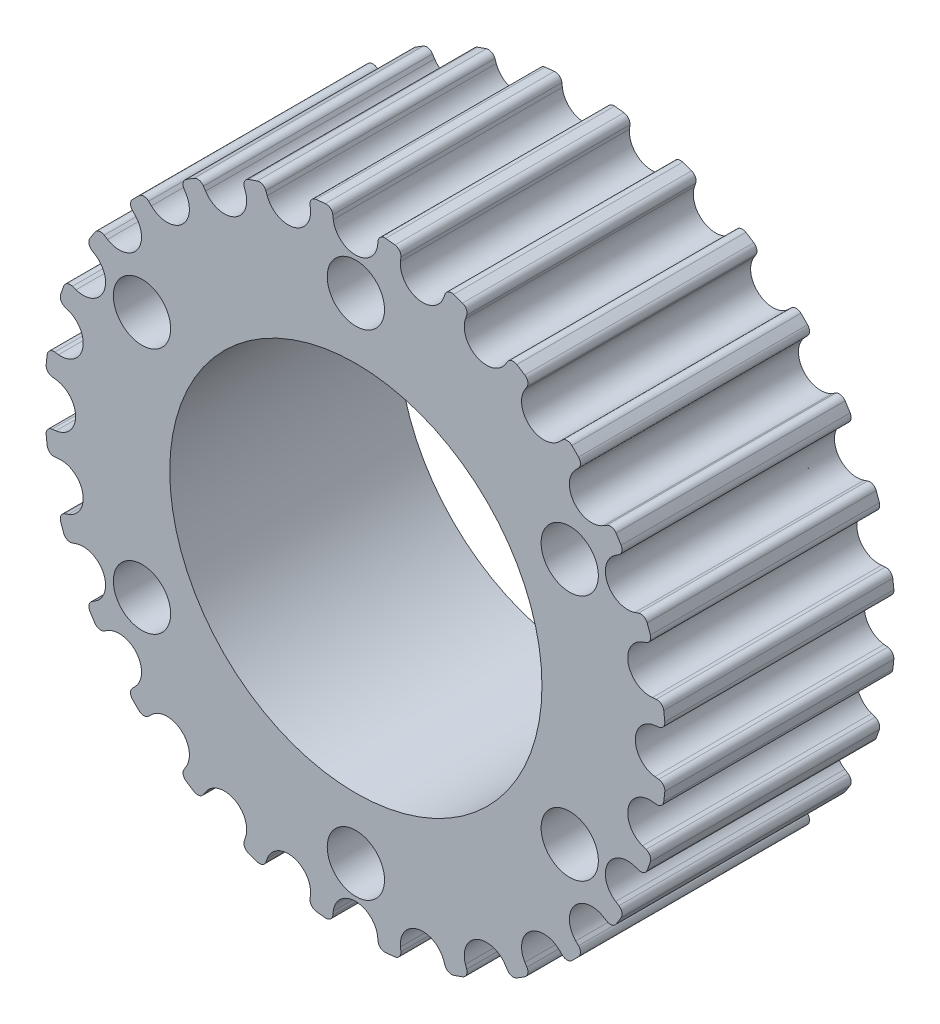
from build123d import *

# Parameters (mm, degrees)
SKETCH_1_R          = 7.5
EXTRUDE_1_DEPTH     = 16
SKETCH_7_R          = 2
SKETCH_7_R_2        = 13
CUT_EXTRUDE_1_DEPTH = 41


with BuildPart() as part:
    # 草图1 → 凸台-拉伸1 (new body)
    with BuildSketch(Plane.XY):
        with BuildLine():
            Line((1.554033471, 21.184411781), (1.521048557, 20.915771216))
            ThreePointArc((1.521048557, 20.915771216), (-0.027323439, 19.545887392), (-1.575695436, 20.915771216))
            Line((-1.575695436, 20.915771216), (-1.608680349, 21.184411781))
            ThreePointArc((-1.608680349, 21.184411781), (-1.784864491, 21.500423691), (-2.131632272, 21.603653945))
            ThreePointArc((-2.131632272, 21.603653945), (-2.457848286, 21.569392044), (-2.783509374, 21.530205035))
            ThreePointArc((-2.783509374, 21.530205035), (-3.09861207, 21.352399889), (-3.200059642, 21.005106398))
            Line((-3.200059642, 21.005106398), (-3.172439406, 20.735861379))
            ThreePointArc((-3.172439406, 20.735861379), (-4.377162656, 19.055778219), (-6.191541562, 20.046771013))
            Line((-6.191541562, 20.046771013), (-6.283477625, 20.301336364))
            ThreePointArc((-6.283477625, 20.301336364), (-6.525563727, 20.570220536), (-6.886608208, 20.593699501))
            ThreePointArc((-6.886608208, 20.593699501), (-7.197021316, 20.487706726), (-7.505797471, 20.377035808))
            ThreePointArc((-7.505797471, 20.377035808), (-7.773434517, 20.133571662), (-7.795058515, 19.772411335))
            Line((-7.795058515, 19.772411335), (-7.708218122, 19.516062931))
            ThreePointArc((-7.708218122, 19.516062931), (-8.508882771, 17.610026822), (-10.498288052, 18.172436068))
            Line((-10.498288052, 18.172436068), (-10.644565205, 18.400161236))
            ThreePointArc((-10.644565205, 18.400161236), (-10.940414061, 18.608434695), (-11.297630964, 18.550985038))
            ThreePointArc((-11.297630964, 18.550985038), (-11.576675756, 18.378576309), (-11.853083652, 18.201970983))
            ThreePointArc((-11.853083652, 18.201970983), (-12.059834609, 17.905056146), (-12.000550715, 17.54813907))
            Line((-12.000550715, 17.54813907), (-11.858844707, 17.317541662))
            ThreePointArc((-11.858844707, 17.317541662), (-12.215302086, 15.281129211), (-14.279976653, 15.386753363))
            Line((-14.279976653, 15.386753363), (-14.47325995, 15.576219257))
            ThreePointArc((-14.47325995, 15.576219257), (-14.808036462, 15.713438301), (-15.14351344, 15.577940788))
            ThreePointArc((-15.14351344, 15.577940788), (-15.377197445, 15.347761398), (-15.607376836, 15.114077393))
            ThreePointArc((-15.607376836, 15.114077393), (-15.742874348, 14.778600415), (-15.605655304, 14.443823903))
            Line((-15.605655304, 14.443823903), (-15.41618941, 14.250540606))
            ThreePointArc((-15.41618941, 14.250540606), (-15.310565258, 12.185866039), (-17.346977709, 11.829408659))
            Line((-17.346977709, 11.829408659), (-17.577575117, 11.971114668))
            ThreePointArc((-17.577575117, 11.971114668), (-17.934492193, 12.030398562), (-18.23140703, 11.823647605))
            ThreePointArc((-18.23140703, 11.823647605), (-18.408012356, 11.547239709), (-18.580421086, 11.268194917))
            ThreePointArc((-18.580421086, 11.268194917), (-18.637870742, 10.910978014), (-18.429597284, 10.615129158))
            Line((-18.429597284, 10.615129158), (-18.201872116, 10.468852005))
            ThreePointArc((-18.201872116, 10.468852005), (-17.639462869, 8.479446724), (-19.545498979, 7.678782075))
            Line((-19.545498979, 7.678782075), (-19.801847382, 7.765622467))
            ThreePointArc((-19.801847382, 7.765622467), (-20.163007709, 7.74399847), (-20.406471855, 7.476361423))
            ThreePointArc((-20.406471855, 7.476361423), (-20.517142773, 7.167585269), (-20.623135549, 6.857172161))
            ThreePointArc((-20.623135549, 6.857172161), (-20.599656583, 6.49612768), (-20.330772412, 6.254041577))
            Line((-20.330772412, 6.254041577), (-20.07620706, 6.162105515))
            ThreePointArc((-20.07620706, 6.162105515), (-19.085214266, 4.347726609), (-20.765297426, 3.143003359))
            Line((-20.765297426, 3.143003359), (-21.034542445, 3.170623595))
            ThreePointArc((-21.034542445, 3.170623595), (-21.381835936, 3.069176023), (-21.559641082, 2.754073327))
            ThreePointArc((-21.559641082, 2.754073327), (-21.598828091, 2.428412239), (-21.633089992, 2.102196225))
            ThreePointArc((-21.633089992, 2.102196225), (-21.529859738, 1.755428444), (-21.213847828, 1.579244302))
            Line((-21.213847828, 1.579244302), (-20.945207263, 1.546259388))
            ThreePointArc((-20.945207263, 1.546259388), (-19.575323439, -0.002112608), (-20.945207263, -1.550484605))
            Line((-20.945207263, -1.550484605), (-21.213847828, -1.583469519))
            ThreePointArc((-21.213847828, -1.583469519), (-21.529859738, -1.75965366), (-21.633089992, -2.106421441))
            ThreePointArc((-21.633089992, -2.106421441), (-21.598828091, -2.432637455), (-21.559641082, -2.758298543))
            ThreePointArc((-21.559641082, -2.758298543), (-21.381835936, -3.073401239), (-21.034542445, -3.174848812))
            Line((-21.034542445, -3.174848812), (-20.765297426, -3.147228575))
            ThreePointArc((-20.765297426, -3.147228575), (-19.085214266, -4.351951825), (-20.07620706, -6.166330731))
            Line((-20.07620706, -6.166330731), (-20.330772412, -6.258266794))
            ThreePointArc((-20.330772412, -6.258266794), (-20.599656583, -6.500352897), (-20.623135549, -6.861397377))
            ThreePointArc((-20.623135549, -6.861397377), (-20.517142773, -7.171810485), (-20.406471855, -7.48058664))
            ThreePointArc((-20.406471855, -7.48058664), (-20.163007709, -7.748223686), (-19.801847382, -7.769847684))
            Line((-19.801847382, -7.769847684), (-19.545498979, -7.683007291))
            ThreePointArc((-19.545498979, -7.683007291), (-17.639462869, -8.48367194), (-18.201872116, -10.473077221))
            Line((-18.201872116, -10.473077221), (-18.429597284, -10.619354374))
            ThreePointArc((-18.429597284, -10.619354374), (-18.637870742, -10.91520323), (-18.580421086, -11.272420133))
            ThreePointArc((-18.580421086, -11.272420133), (-18.408012356, -11.551464925), (-18.23140703, -11.827872821))
            ThreePointArc((-18.23140703, -11.827872821), (-17.934492193, -12.034623778), (-17.577575117, -11.975339884))
            Line((-17.577575117, -11.975339884), (-17.346977709, -11.833633876))
            ThreePointArc((-17.346977709, -11.833633876), (-15.310565258, -12.190091255), (-15.41618941, -14.254765823))
            Line((-15.41618941, -14.254765823), (-15.605655304, -14.448049119))
            ThreePointArc((-15.605655304, -14.448049119), (-15.742874348, -14.782825631), (-15.607376836, -15.11830261))
            ThreePointArc((-15.607376836, -15.11830261), (-15.377197445, -15.351986614), (-15.14351344, -15.582166005))
            ThreePointArc((-15.14351344, -15.582166005), (-14.808036462, -15.717663517), (-14.47325995, -15.580444473))
            Line((-14.47325995, -15.580444473), (-14.279976653, -15.390978579))
            ThreePointArc((-14.279976653, -15.390978579), (-12.215302086, -15.285354427), (-11.858844707, -17.321766878))
            Line((-11.858844707, -17.321766878), (-12.000550715, -17.552364287))
            ThreePointArc((-12.000550715, -17.552364287), (-12.059834609, -17.909281362), (-11.853083652, -18.206196199))
            ThreePointArc((-11.853083652, -18.206196199), (-11.576675756, -18.382801525), (-11.297630964, -18.555210255))
            ThreePointArc((-11.297630964, -18.555210255), (-10.940414061, -18.612659911), (-10.644565205, -18.404386453))
            Line((-10.644565205, -18.404386453), (-10.498288052, -18.176661285))
            ThreePointArc((-10.498288052, -18.176661285), (-8.508882771, -17.614252038), (-7.708218122, -19.520288148))
            Line((-7.708218122, -19.520288148), (-7.795058515, -19.776636551))
            ThreePointArc((-7.795058515, -19.776636551), (-7.773434517, -20.137796878), (-7.505797471, -20.381261024))
            ThreePointArc((-7.505797471, -20.381261024), (-7.197021316, -20.491931943), (-6.886608208, -20.597924718))
            ThreePointArc((-6.886608208, -20.597924718), (-6.525563727, -20.574445752), (-6.283477625, -20.305561581))
            Line((-6.283477625, -20.305561581), (-6.191541562, -20.050996229))
            ThreePointArc((-6.191541562, -20.050996229), (-4.377162656, -19.060003436), (-3.172439406, -20.740086595))
            Line((-3.172439406, -20.740086595), (-3.200059642, -21.009331614))
            ThreePointArc((-3.200059642, -21.009331614), (-3.09861207, -21.356625105), (-2.783509374, -21.534430251))
            ThreePointArc((-2.783509374, -21.534430251), (-2.457848286, -21.573617261), (-2.131632272, -21.607879161))
            ThreePointArc((-2.131632272, -21.607879161), (-1.784864491, -21.504648907), (-1.608680349, -21.188636997))
            Line((-1.608680349, -21.188636997), (-1.575695436, -20.919996432))
            ThreePointArc((-1.575695436, -20.919996432), (-0.027323439, -19.550112608), (1.521048557, -20.919996432))
            Line((1.521048557, -20.919996432), (1.554033471, -21.188636997))
            ThreePointArc((1.554033471, -21.188636997), (1.730217613, -21.504648907), (2.076985394, -21.607879161))
            ThreePointArc((2.076985394, -21.607879161), (2.403201408, -21.573617261), (2.728862496, -21.534430251))
            ThreePointArc((2.728862496, -21.534430251), (3.043965192, -21.356625105), (3.145412764, -21.009331614))
            Line((3.145412764, -21.009331614), (3.117792528, -20.740086595))
            ThreePointArc((3.117792528, -20.740086595), (4.322515778, -19.060003436), (6.136894684, -20.050996229))
            Line((6.136894684, -20.050996229), (6.228830746, -20.305561581))
            ThreePointArc((6.228830746, -20.305561581), (6.470916849, -20.574445752), (6.83196133, -20.597924718))
            ThreePointArc((6.83196133, -20.597924718), (7.142374438, -20.491931943), (7.451150593, -20.381261024))
            ThreePointArc((7.451150593, -20.381261024), (7.718787639, -20.137796878), (7.740411637, -19.776636551))
            Line((7.740411637, -19.776636551), (7.653571244, -19.520288148))
            ThreePointArc((7.653571244, -19.520288148), (8.454235893, -17.614252038), (10.443641174, -18.176661285))
            Line((10.443641174, -18.176661285), (10.589918327, -18.404386453))
            ThreePointArc((10.589918327, -18.404386453), (10.885767183, -18.612659911), (11.242984086, -18.555210255))
            ThreePointArc((11.242984086, -18.555210255), (11.522028878, -18.382801525), (11.798436774, -18.206196199))
            ThreePointArc((11.798436774, -18.206196199), (12.005187731, -17.909281362), (11.945903837, -17.552364287))
            Line((11.945903837, -17.552364287), (11.804197828, -17.321766878))
            ThreePointArc((11.804197828, -17.321766878), (12.160655208, -15.285354427), (14.225329775, -15.390978579))
            Line((14.225329775, -15.390978579), (14.418613072, -15.580444473))
            ThreePointArc((14.418613072, -15.580444473), (14.753389584, -15.717663517), (15.088866562, -15.582166005))
            ThreePointArc((15.088866562, -15.582166005), (15.322550567, -15.351986614), (15.552729958, -15.11830261))
            ThreePointArc((15.552729958, -15.11830261), (15.68822747, -14.782825631), (15.551008426, -14.448049119))
            Line((15.551008426, -14.448049119), (15.361542532, -14.254765823))
            ThreePointArc((15.361542532, -14.254765823), (15.25591838, -12.190091255), (17.292330831, -11.833633876))
            Line((17.292330831, -11.833633876), (17.522928239, -11.975339884))
            ThreePointArc((17.522928239, -11.975339884), (17.879845315, -12.034623778), (18.176760152, -11.827872821))
            ThreePointArc((18.176760152, -11.827872821), (18.353365478, -11.551464925), (18.525774208, -11.272420133))
            ThreePointArc((18.525774208, -11.272420133), (18.583223864, -10.91520323), (18.374950406, -10.619354374))
            Line((18.374950406, -10.619354374), (18.147225238, -10.473077221))
            ThreePointArc((18.147225238, -10.473077221), (17.584815991, -8.48367194), (19.4908521, -7.683007291))
            Line((19.4908521, -7.683007291), (19.747200504, -7.769847684))
            ThreePointArc((19.747200504, -7.769847684), (20.108360831, -7.748223686), (20.351824977, -7.48058664))
            ThreePointArc((20.351824977, -7.48058664), (20.462495895, -7.171810485), (20.568488671, -6.861397377))
            ThreePointArc((20.568488671, -6.861397377), (20.545009705, -6.500352897), (20.276125534, -6.258266794))
            Line((20.276125534, -6.258266794), (20.021560182, -6.166330731))
            ThreePointArc((20.021560182, -6.166330731), (19.030567388, -4.351951825), (20.710650548, -3.147228575))
            Line((20.710650548, -3.147228575), (20.979895567, -3.174848812))
            ThreePointArc((20.979895567, -3.174848812), (21.327189058, -3.073401239), (21.504994204, -2.758298543))
            ThreePointArc((21.504994204, -2.758298543), (21.544181213, -2.432637455), (21.578443114, -2.106421441))
            ThreePointArc((21.578443114, -2.106421441), (21.47521286, -1.75965366), (21.15920095, -1.583469519))
            Line((21.15920095, -1.583469519), (20.890560385, -1.550484605))
            ThreePointArc((20.890560385, -1.550484605), (19.520676561, -0.002112608), (20.890560385, 1.546259388))
            Line((20.890560385, 1.546259388), (21.15920095, 1.579244302))
            ThreePointArc((21.15920095, 1.579244302), (21.47521286, 1.755428444), (21.578443114, 2.102196225))
            ThreePointArc((21.578443114, 2.102196225), (21.544181213, 2.428412239), (21.504994204, 2.754073327))
            ThreePointArc((21.504994204, 2.754073327), (21.327189058, 3.069176023), (20.979895567, 3.170623595))
            Line((20.979895567, 3.170623595), (20.710650548, 3.143003359))
            ThreePointArc((20.710650548, 3.143003359), (19.030567388, 4.347726609), (20.021560182, 6.162105515))
            Line((20.021560182, 6.162105515), (20.276125534, 6.254041577))
            ThreePointArc((20.276125534, 6.254041577), (20.545009705, 6.49612768), (20.568488671, 6.857172161))
            ThreePointArc((20.568488671, 6.857172161), (20.462495895, 7.167585269), (20.351824977, 7.476361423))
            ThreePointArc((20.351824977, 7.476361423), (20.108360831, 7.74399847), (19.747200504, 7.765622467))
            Line((19.747200504, 7.765622467), (19.4908521, 7.678782075))
            ThreePointArc((19.4908521, 7.678782075), (17.584815991, 8.479446724), (18.147225238, 10.468852005))
            Line((18.147225238, 10.468852005), (18.374950406, 10.615129158))
            ThreePointArc((18.374950406, 10.615129158), (18.583223864, 10.910978014), (18.525774208, 11.268194917))
            ThreePointArc((18.525774208, 11.268194917), (18.353365478, 11.547239709), (18.176760152, 11.823647605))
            ThreePointArc((18.176760152, 11.823647605), (17.879845315, 12.030398562), (17.522928239, 11.971114668))
            Line((17.522928239, 11.971114668), (17.292330831, 11.829408659))
            ThreePointArc((17.292330831, 11.829408659), (15.25591838, 12.185866039), (15.361542532, 14.250540606))
            Line((15.361542532, 14.250540606), (15.551008426, 14.443823903))
            ThreePointArc((15.551008426, 14.443823903), (15.68822747, 14.778600415), (15.552729958, 15.114077393))
            ThreePointArc((15.552729958, 15.114077393), (15.322550567, 15.347761398), (15.088866562, 15.577940788))
            ThreePointArc((15.088866562, 15.577940788), (14.753389584, 15.713438301), (14.418613072, 15.576219257))
            Line((14.418613072, 15.576219257), (14.225329775, 15.386753363))
            ThreePointArc((14.225329775, 15.386753363), (12.160655208, 15.281129211), (11.804197828, 17.317541662))
            Line((11.804197828, 17.317541662), (11.945903837, 17.54813907))
            ThreePointArc((11.945903837, 17.54813907), (12.005187731, 17.905056146), (11.798436774, 18.201970983))
            ThreePointArc((11.798436774, 18.201970983), (11.522028878, 18.378576309), (11.242984086, 18.550985038))
            ThreePointArc((11.242984086, 18.550985038), (10.885767183, 18.608434695), (10.589918327, 18.400161236))
            Line((10.589918327, 18.400161236), (10.443641174, 18.172436068))
            ThreePointArc((10.443641174, 18.172436068), (8.454235893, 17.610026822), (7.653571244, 19.516062931))
            Line((7.653571244, 19.516062931), (7.740411637, 19.772411335))
            ThreePointArc((7.740411637, 19.772411335), (7.718787639, 20.133571662), (7.451150593, 20.377035808))
            ThreePointArc((7.451150593, 20.377035808), (7.142374438, 20.487706726), (6.83196133, 20.593699501))
            ThreePointArc((6.83196133, 20.593699501), (6.470916849, 20.570220536), (6.228830746, 20.301336364))
            Line((6.228830746, 20.301336364), (6.136894684, 20.046771013))
            ThreePointArc((6.136894684, 20.046771013), (4.322515778, 19.055778219), (3.117792528, 20.735861379))
            Line((3.117792528, 20.735861379), (3.145412764, 21.005106398))
            ThreePointArc((3.145412764, 21.005106398), (3.043965192, 21.352399889), (2.728862496, 21.530205035))
            ThreePointArc((2.728862496, 21.530205035), (2.403201408, 21.569392044), (2.076985394, 21.603653945))
            ThreePointArc((2.076985394, 21.603653945), (1.730217613, 21.500423691), (1.554033471, 21.184411781))
        make_face()
        with Locations((-0.027323439, -0.002112608)):
            Circle(SKETCH_1_R, mode=Mode.SUBTRACT)
    extrude(amount=EXTRUDE_1_DEPTH)

    # 草图7 → 切除-拉伸1 (cut)
    with BuildSketch(Plane(origin=(0, 0, 0), x_dir=(-1, 0, 0), z_dir=(0, 0, -1))):
        with Locations((0, 17.25)):
            Circle(SKETCH_7_R)
        with Locations((14.938938215, 8.625)):
            Circle(SKETCH_7_R)
        with Locations((14.938938215, -8.625)):
            Circle(SKETCH_7_R)
        with Locations((0, -17.25)):
            Circle(SKETCH_7_R)
        with Locations((-14.938938215, -8.625)):
            Circle(SKETCH_7_R)
        with Locations((-14.938938215, 8.625)):
            Circle(SKETCH_7_R)
        Circle(SKETCH_7_R_2)
    extrude(amount=-CUT_EXTRUDE_1_DEPTH, mode=Mode.SUBTRACT)


solid = part.part
